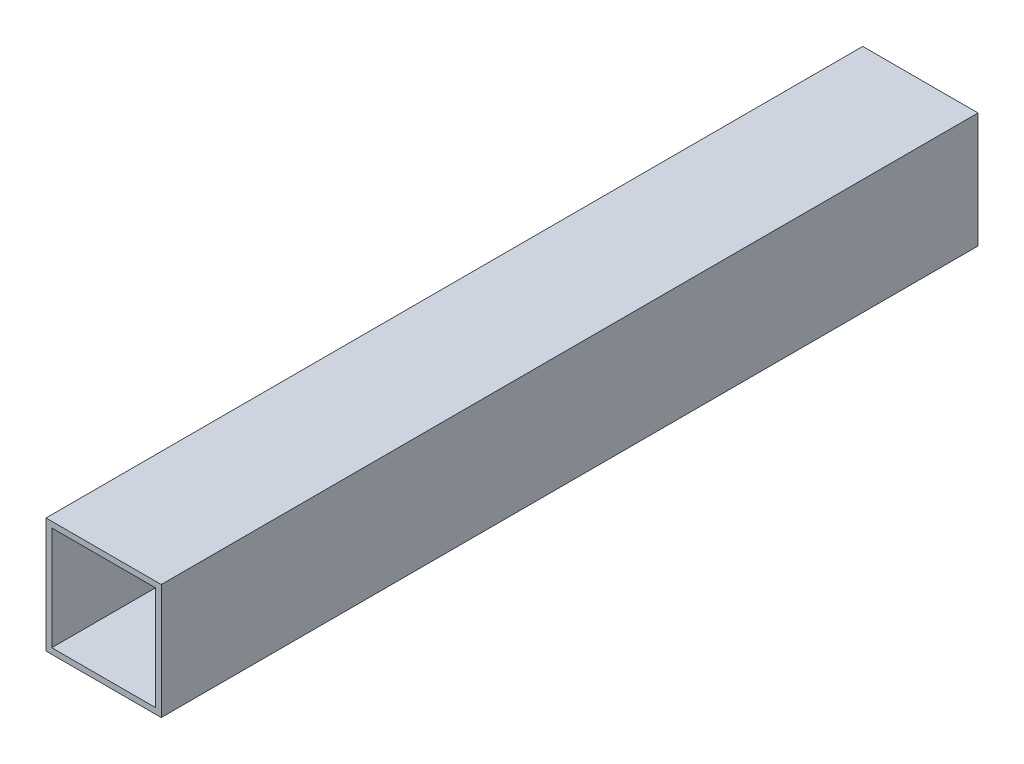
from build123d import *

# Parameters (mm, degrees)
SKETCH1_W           = 31.75
SKETCH1_H           = 31.75
SKETCH1_W_2         = 28.575
SKETCH1_H_2         = 28.575
BOSS_EXTRUDE1_DEPTH = 225


with BuildPart() as part:
    # Sketch1 → Boss-Extrude1 (new body)
    with BuildSketch(Plane.XY):
        Rectangle(SKETCH1_W, SKETCH1_H)
        Rectangle(SKETCH1_W_2, SKETCH1_H_2, mode=Mode.SUBTRACT)
    extrude(amount=BOSS_EXTRUDE1_DEPTH)


solid = part.part
